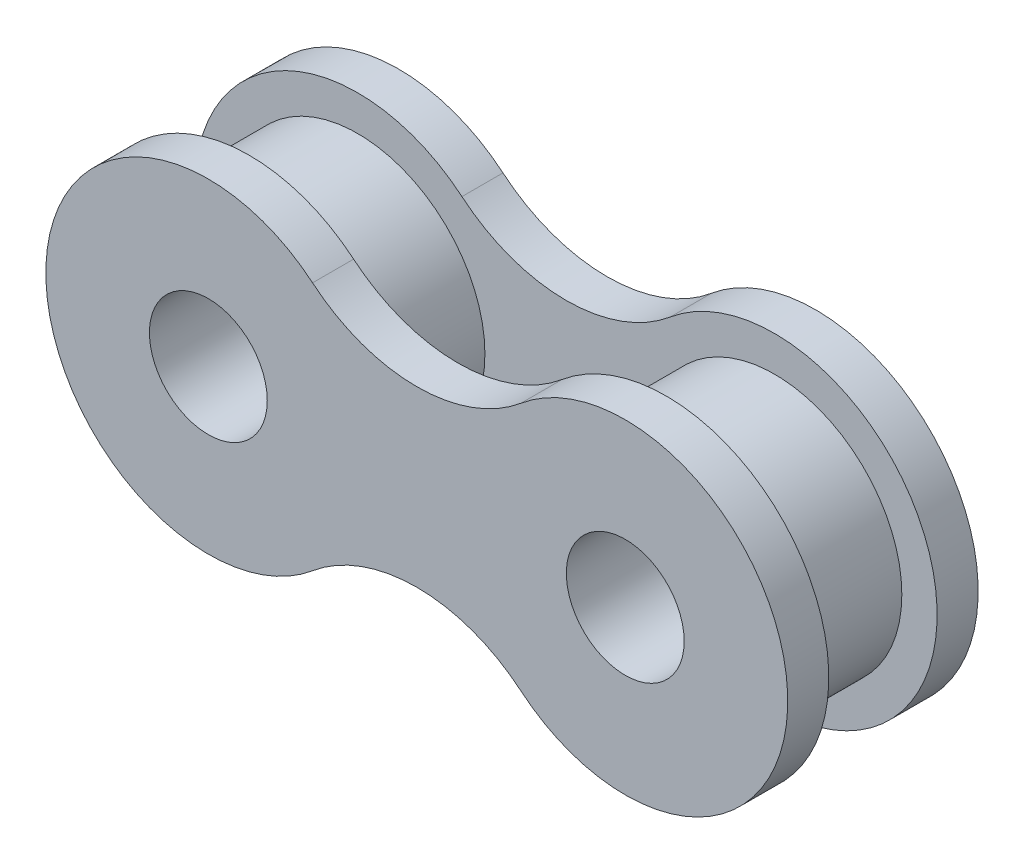
from build123d import *

# Parameters (mm, degrees)
SKETCH_4_R           = 3.875
SKETCH_4_R_2         = 1.795
EXTRUDE_3_DEPTH      = 1.25
EXTRUDE_4_DEPTH      = 1.65
EXTRUDE_4_DEPTH_BACK = 2.9
SKETCH_1_R           = 3.875
SKETCH_1_R_2         = 1.795


with BuildPart() as part:
    # Эскиз4 → Бобышка-Вытянуть3 (new body)
    # profile 1 of 3: a face of its own
    with BuildSketch(Plane.XY.offset(2.9)):
        with BuildLine():
            ThreePointArc((3.175, -8.746386407), (0, -7.594000789), (-3.175, -8.746386407))
            ThreePointArc((-3.175, -8.746386407), (-11.3, -4.948772024), (-3.175, -1.151157641))
            ThreePointArc((-3.175, -1.151157641), (0, -2.303543258), (3.175, -1.151157641))
            ThreePointArc((3.175, -1.151157641), (11.3, -4.948772024), (3.175, -8.746386407))
        make_face()
        with Locations((-6.35, -4.948772024)):
            Circle(SKETCH_4_R, mode=Mode.SUBTRACT)
        with Locations((6.35, -4.948772024)):
            Circle(SKETCH_4_R, mode=Mode.SUBTRACT)
    # profile 2 of 3: a face of its own
    with BuildSketch(Plane.XY.offset(2.9)):
        with Locations((-6.35, -4.948772024)):
            Circle(SKETCH_4_R)
        with Locations((-6.35, -4.948772024)):
            Circle(SKETCH_4_R_2, mode=Mode.SUBTRACT)
    # profile 3 of 3: a face of its own
    with BuildSketch(Plane.XY.offset(2.9)):
        with Locations((6.35, -4.948772024)):
            Circle(SKETCH_4_R)
        with Locations((6.35, -4.948772024)):
            Circle(SKETCH_4_R_2, mode=Mode.SUBTRACT)
    extrude(amount=-EXTRUDE_3_DEPTH)


with BuildPart() as body_2:
    # Зеркальное отражение6: mirrored copy
    add(part.part.mirror(Plane.XY))


with BuildPart() as part_1:
    add(part.part)

    add(body_2.part)  # Бобышка-Вытянуть4 merges body 2
    # Эскиз1 → Бобышка-Вытянуть4 (add, two sides: drawn at the far end of the back side and taken through both)
    # profile 1 of 2: a face of its own
    with BuildSketch(Plane.XY.offset(-EXTRUDE_4_DEPTH_BACK)):
        with Locations((-6.35, -4.948772024)):
            Circle(SKETCH_1_R)
        with Locations((-6.35, -4.948772024)):
            Circle(SKETCH_1_R_2, mode=Mode.SUBTRACT)
    # profile 2 of 2: a face of its own
    with BuildSketch(Plane.XY.offset(-EXTRUDE_4_DEPTH_BACK)):
        with Locations((6.35, -4.948772024)):
            Circle(SKETCH_1_R)
        with Locations((6.35, -4.948772024)):
            Circle(SKETCH_1_R_2, mode=Mode.SUBTRACT)
    extrude(amount=EXTRUDE_4_DEPTH + EXTRUDE_4_DEPTH_BACK)


solid = part_1.part
